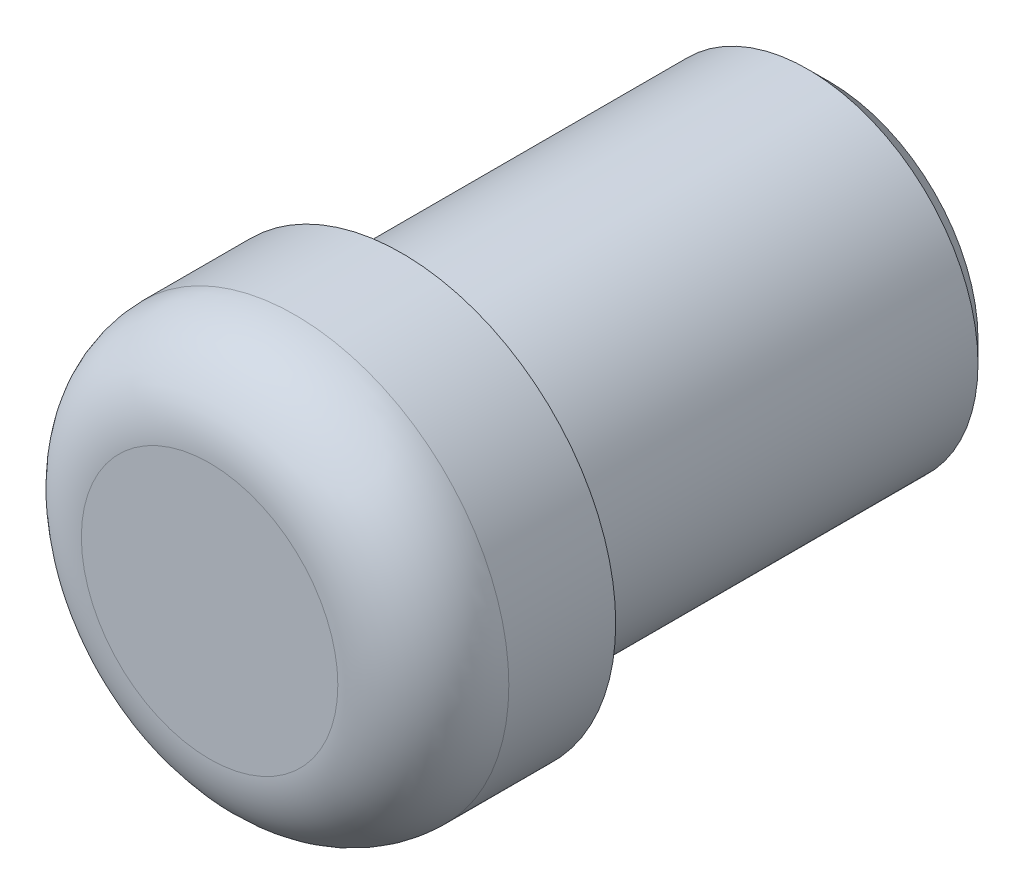
from build123d import *

# Parameters (mm, degrees)
SKETCH1_R           = 3.975
BOSS_EXTRUDE1_DEPTH = 10
SKETCH2_R           = 5
BOSS_EXTRUDE2_DEPTH = 4.5
FILLET4_R           = 2
FILLET5_R           = 0.5
CHAMFER1_SIZE       = 0.5


with BuildPart() as part:
    # Sketch1 → Boss-Extrude1 (new body)
    with BuildSketch(Plane.XY):
        Circle(SKETCH1_R)
    extrude(amount=BOSS_EXTRUDE1_DEPTH)

    # Sketch2 → Boss-Extrude2 (add)
    with BuildSketch(Plane.XY.offset(10)):
        Circle(SKETCH2_R)
    extrude(amount=BOSS_EXTRUDE2_DEPTH)

    # Fillet4
    fillet4_edges = [part.edges().sort_by_distance(p)[0] for p in [
        (-5, 0, 14.5),
    ]]
    fillet(fillet4_edges, radius=FILLET4_R)

    # Fillet5
    fillet5_edges = [part.edges().sort_by_distance(p)[0] for p in [
        (-3.975, 0, 10),
    ]]
    fillet(fillet5_edges, radius=FILLET5_R)

    # Chamfer1
    chamfer1_edges = [part.edges().sort_by_distance(p)[0] for p in [
        (-3.975, 0, 0),
    ]]
    chamfer(chamfer1_edges, length=CHAMFER1_SIZE)


solid = part.part
